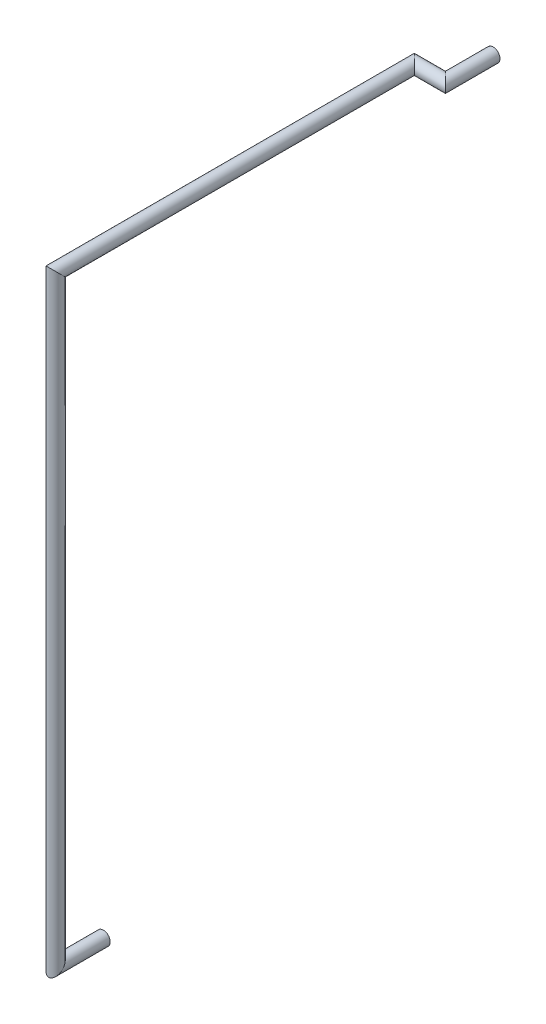
from build123d import *

# Parameters (mm, degrees)
ESQUISSE1_R = 0.5


with BuildPart() as part:
    # Balayage1: sweep along a curve in space
    with BuildLine() as balayage1_path:
        Line((0, 0, 0), (0, 0, 3.5))
        Line((0, 0, 3.5), (0, 44.06, 3.5))
        Line((0, 44.06, 3.5), (0, 44.06, -22.79))
        Line((0, 44.06, -22.79), (2.28, 44.06, -22.79))
        Line((2.28, 44.06, -22.79), (2.28, 44.06, -26.29))
    # Esquisse1 → Balayage1 (sweep)
    with BuildSketch(Plane(origin=(0, 0, 0), x_dir=(0, 1, 0), z_dir=(0, 0, 1))):
        Circle(ESQUISSE1_R)
    sweep(path=balayage1_path.line, transition=Transition.RIGHT)


solid = part.part
